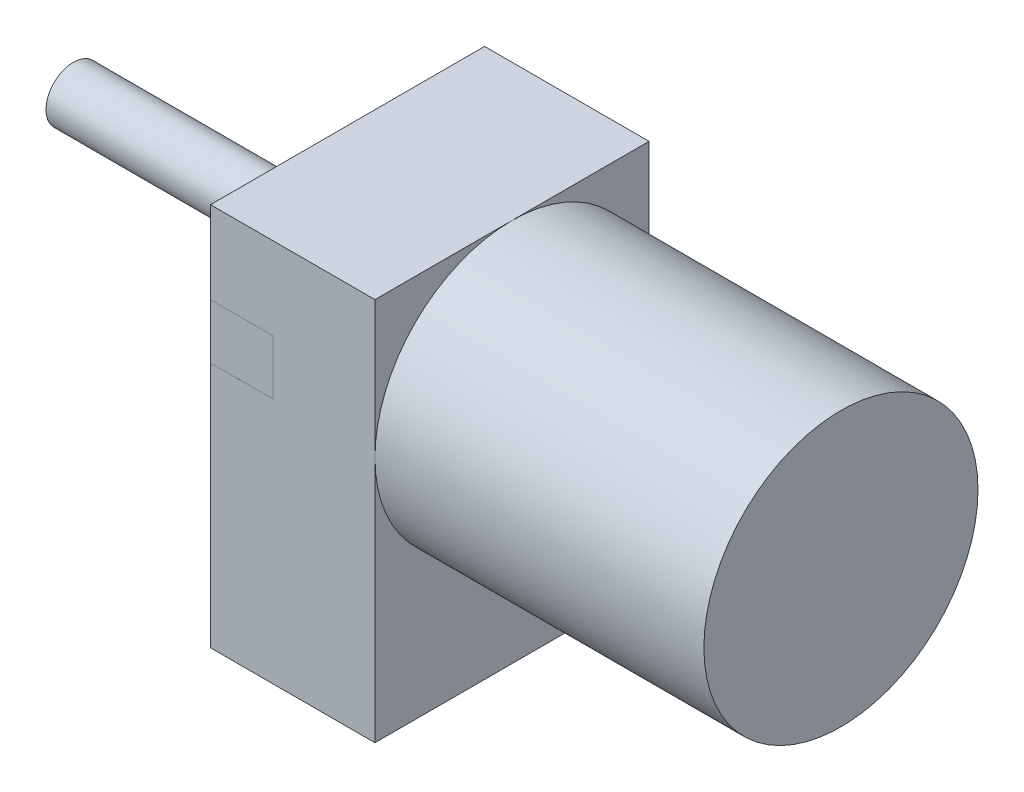
from build123d import *

# Parameters (mm, degrees)
ESQUISSE1_W             = 15
ESQUISSE1_H             = 35
EXTRUSION1_DEPTH        = 25
ESQUISSE2_R             = 12.5
EXTRUSION2_DEPTH        = 30
ESQUISSE3_R             = 2.5
EXTRUSION4_DEPTH        = 25
ESQUISSE4_W             = 5.704163369
ESQUISSE4_H             = 5
ENL_V_MAT_EXTRU_1_DEPTH = 0.0001
ESQUISSE5_W             = 5.704163369
ESQUISSE5_H             = 5
ENL_V_MAT_EXTRU_2_DEPTH = 0.0001


with BuildPart() as part:
    # Esquisse1 → Extrusion1 (new body)
    with BuildSketch(Plane.XY):
        with Locations((-7.5, 17.5)):
            Rectangle(ESQUISSE1_W, ESQUISSE1_H)
    extrude(amount=EXTRUSION1_DEPTH)

    # Esquisse2 → Extrusion2 (add)
    with BuildSketch(Plane(origin=(0, 0, 0), x_dir=(0, 0, -1), z_dir=(1, 0, 0))):
        with Locations((-12.5, 22.5)):
            Circle(ESQUISSE2_R)
    extrude(amount=EXTRUSION2_DEPTH)

    # Esquisse3 → Extrusion4 (add)
    with BuildSketch(Plane.ZY.offset(15)):
        with Locations(Location((12.5, 25, 0), (0, 0, 180))):
            Circle(ESQUISSE3_R)
    extrude(amount=EXTRUSION4_DEPTH)

    # Esquisse4 → Enlèv. mat.-Extru.1 (cut)
    with BuildSketch(Plane.XY.offset(25)):
        with Locations((-12.147918316, 25)):
            Rectangle(ESQUISSE4_W, ESQUISSE4_H)
    extrude(amount=-ENL_V_MAT_EXTRU_1_DEPTH, mode=Mode.SUBTRACT)

    # Esquisse5 → Enlèv. mat.-Extru.2 (cut)
    with BuildSketch(Plane(origin=(0, 0, 0), x_dir=(-1, 0, 0), z_dir=(0, 0, -1))):
        with Locations((12.129729433, 24.948694164)):
            Rectangle(ESQUISSE5_W, ESQUISSE5_H)
    extrude(amount=-ENL_V_MAT_EXTRU_2_DEPTH, mode=Mode.SUBTRACT)


solid = part.part
